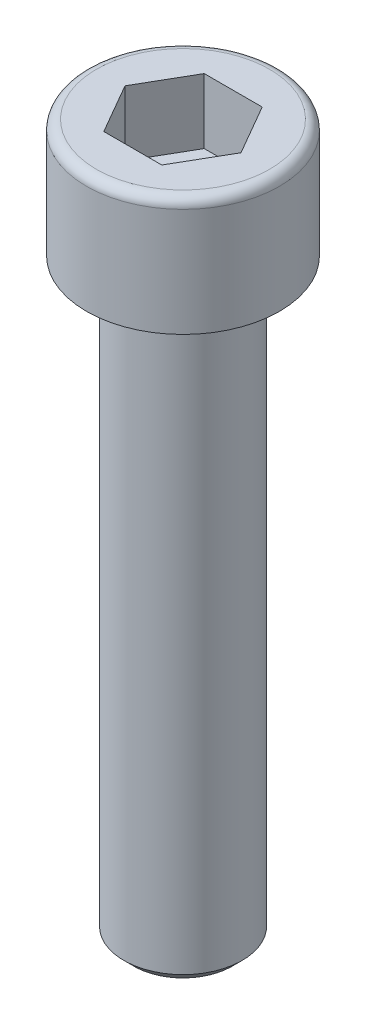
from build123d import *

# Parameters (mm, degrees)
ESQUISSE1_W             = 4.9
ESQUISSE1_H             = 6
ESQUISSE2_R             = 3
BOSS_EXTRU_1_DEPTH      = 30
ENL_V_MAT_EXTRU_1_DEPTH = 3.3
CHANFREIN1_SIZE         = 0.5
CONG_1_R                = 0.5


with BuildPart() as part:
    # Esquisse1 → Révolution1 (revolve)
    with BuildSketch(Plane.XY, mode=Mode.PRIVATE) as r_volution1_sk:
        with Locations((2.45, 3)):
            Rectangle(ESQUISSE1_W, ESQUISSE1_H)
    revolve(r_volution1_sk.sketch.rotate(Axis((0, 6, 0), (0, -1, 0)), 270), axis=Axis((0, 6, 0), (0, -1, 0)))

    # Esquisse2 → Boss.-Extru.1 (add)
    with BuildSketch(Plane.XZ):
        with Locations(Location((0, 0, 0), (0, 0, 270))):
            Circle(ESQUISSE2_R)
    extrude(amount=BOSS_EXTRU_1_DEPTH)

    # Esquisse3 → Enlèv. mat.-Extru.1 (cut)
    with BuildSketch(Plane(origin=(0, 6, 0), x_dir=(-1, 0, 0), z_dir=(0, 1, 0))):
        Polygon((1.472243186, 2.55), (-1.472243186, 2.55), (-2.944486373, 0), (-1.472243186, -2.55), (1.472243186, -2.55), (2.944486373, 0), align=None)
    extrude(amount=-ENL_V_MAT_EXTRU_1_DEPTH, mode=Mode.SUBTRACT)

    # Chanfrein1
    chanfrein1_edges = [part.edges().sort_by_distance(p)[0] for p in [
        (0, -30, 3),
    ]]
    chamfer(chanfrein1_edges, length=CHANFREIN1_SIZE)

    # Congé1
    cong_1_edges = [part.edges().sort_by_distance(p)[0] for p in [
        (0, 6, 4.9),
    ]]
    fillet(cong_1_edges, radius=CONG_1_R)


solid = part.part
